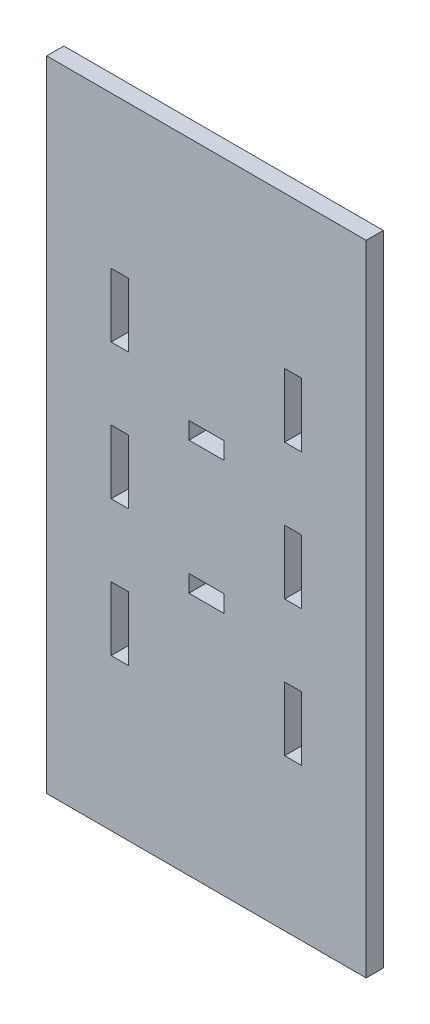
from build123d import *

# Parameters (mm, degrees)
MODEL_W             = 100.00000149
MODEL_H             = 200.00000298
MODEL_W_2           = 10.99999994
MODEL_H_2           = 5.349999876
MODEL_H_3           = 5.350001156
MODEL_W_3           = 5.349999294
MODEL_H_4           = 20.000000019
MODEL_H_5           = 20.000000484
MODEL_H_6           = 19.999999553
BOSS_EXTRUDE1_DEPTH = 5.35


with BuildPart() as part:
    # Model → Boss-Extrude1 (new body)
    with BuildSketch(Plane.XY):
        with Locations((50.000000745, 100.00000149)):
            Rectangle(MODEL_W, MODEL_H)
        with Locations((50.000000745, 79.25000292)):
            Rectangle(MODEL_W_2, MODEL_H_2, mode=Mode.SUBTRACT)
        with Locations((50.000000745, 120.750002563)):
            Rectangle(MODEL_W_2, MODEL_H_3, mode=Mode.SUBTRACT)
        with Locations((22.84500096, 57.500003139)):
            Rectangle(MODEL_W_3, MODEL_H_4, mode=Mode.SUBTRACT)
        with Locations((22.84500096, 100.000002887)):
            Rectangle(MODEL_W_3, MODEL_H_5, mode=Mode.SUBTRACT)
        with Locations((22.84500096, 142.5000038)):
            Rectangle(MODEL_W_3, MODEL_H_6, mode=Mode.SUBTRACT)
        with Locations((77.15500053, 142.5000038)):
            Rectangle(MODEL_W_3, MODEL_H_6, mode=Mode.SUBTRACT)
        with Locations((77.15500053, 100.000002887)):
            Rectangle(MODEL_W_3, MODEL_H_5, mode=Mode.SUBTRACT)
        with Locations((77.15500053, 57.500003139)):
            Rectangle(MODEL_W_3, MODEL_H_4, mode=Mode.SUBTRACT)
    extrude(amount=BOSS_EXTRUDE1_DEPTH)


solid = part.part
